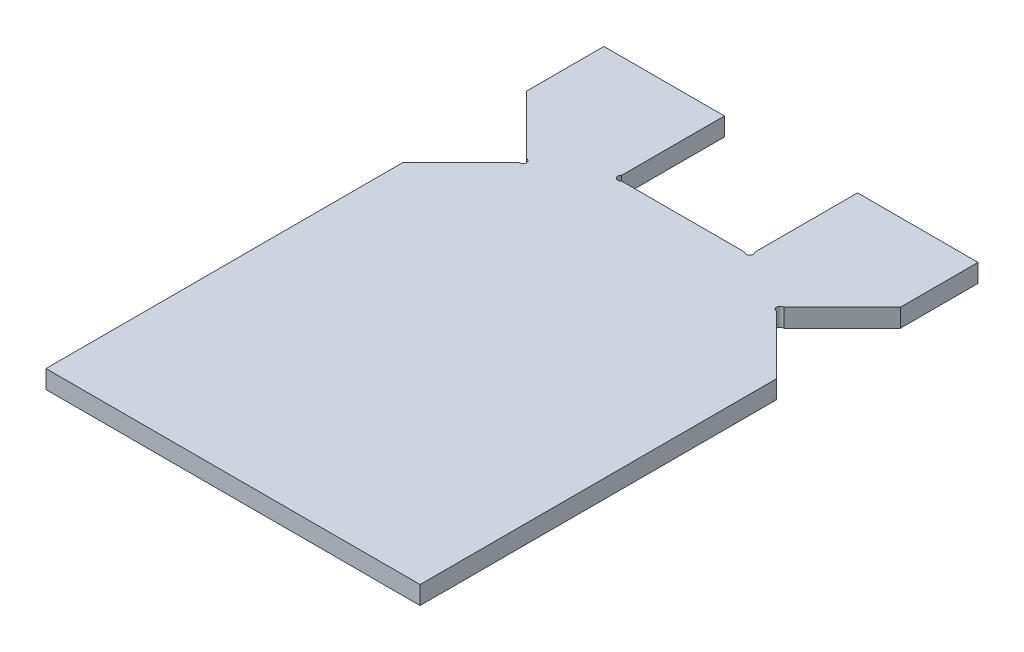
from build123d import *

# Parameters (mm, degrees)
BOSS_EXTRUDE1_DEPTH         = 18.25625
CUT_EXTRUDE1_DEPTH          = 590.645135899
F_1_4_CLEARANCE_HOLE1_D     = 7.14248
F_1_4_CLEARANCE_HOLE1_DEPTH = 18.25625


with BuildPart() as part:
    # Sketch1 → Boss-Extrude1 (new body)
    with BuildSketch(Plane(origin=(0, 0, 0), x_dir=(1, 0, 0), z_dir=(0, 1, 0))):
        Polygon((-187.325, -558.8), (187.325, -558.8), (187.325, 0), (66.675, 0), (66.675, -107.95), (-66.675, -107.95), (-66.675, 0), (-187.325, 0), align=None)
    extrude(amount=BOSS_EXTRUDE1_DEPTH)

    # Sketch2 → Cut-Extrude1 (cut, through all)
    with BuildSketch(Plane(origin=(0, 18.25625, 0), x_dir=(1, 0, 0), z_dir=(0, 1, 0))):
        Polygon((-187.325, -201.6125), (-125.4125, -139.7), (-187.325, -77.7875), align=None)
        Polygon((125.4125, -139.7), (187.325, -201.6125), (187.325, -77.7875), align=None)
    extrude(amount=-CUT_EXTRUDE1_DEPTH, mode=Mode.SUBTRACT)

    # 1/4 Clearance Hole1
    with Locations(Plane(origin=(0, 18.25625, 0), x_dir=(1, 0, 0), z_dir=(0, 1, 0))):
        with Locations((-64.29375, -105.56875), (64.29375, -105.56875), (-128.780096045, -139.7), (128.780096045, -139.7)):
            Hole(F_1_4_CLEARANCE_HOLE1_D / 2, depth=F_1_4_CLEARANCE_HOLE1_DEPTH)


solid = part.part
